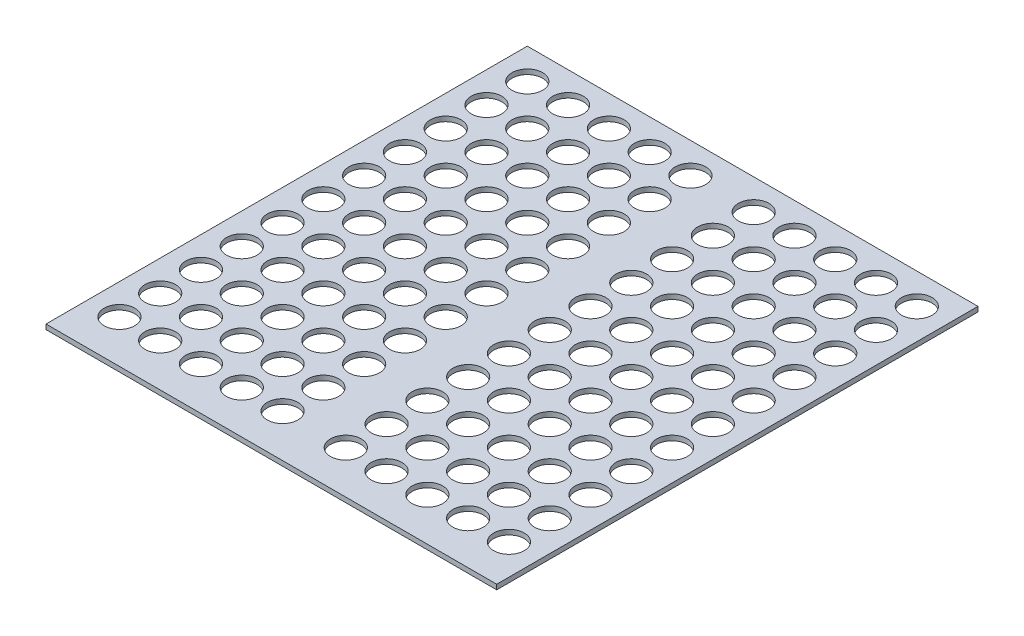
from build123d import *

# Parameters (mm, degrees)
SKETCH1_W           = 110.5
SKETCH1_H           = 118
BOSS_EXTRUDE1_DEPTH = 1.2
CUT_EXTRUDE1_REACH  = 82.839
SKETCH2_R           = 3.75
LPATTERN1_COUNT     = 11
LPATTERN1_PITCH     = 10


with BuildPart() as part:
    # Sketch1 → Boss-Extrude1 (new body)
    with BuildSketch(Plane(origin=(0, 0, 0), x_dir=(1, 0, 0), z_dir=(0, 1, 0))):
        Rectangle(SKETCH1_W, SKETCH1_H)
    extrude(amount=BOSS_EXTRUDE1_DEPTH)

    # Sketch2 → Cut-Extrude1 (cut, up to next)
    with BuildSketch(Plane(origin=(0, 1.2, 0), x_dir=(1, 0, 0), z_dir=(0, 1, 0)), mode=Mode.PRIVATE) as cut_extrude1_sk1:
        with Locations(Location((-27.75, 51.5, 0), (0, 0, 270))):
            Circle(SKETCH2_R)
    cut_extrude1_tool1 = extrude(cut_extrude1_sk1.sketch, amount=-CUT_EXTRUDE1_REACH, mode=Mode.PRIVATE) & part.part
    # Sketch2 → Cut-Extrude1 (cut, up to next)
    with BuildSketch(Plane(origin=(0, 1.2, 0), x_dir=(1, 0, 0), z_dir=(0, 1, 0)), mode=Mode.PRIVATE) as cut_extrude1_sk2:
        with Locations(Location((-47.75, 51.5, 0), (0, 0, 270))):
            Circle(SKETCH2_R)
    cut_extrude1_tool2 = extrude(cut_extrude1_sk2.sketch, amount=-CUT_EXTRUDE1_REACH, mode=Mode.PRIVATE) & part.part
    # Sketch2 → Cut-Extrude1 (cut, up to next)
    with BuildSketch(Plane(origin=(0, 1.2, 0), x_dir=(1, 0, 0), z_dir=(0, 1, 0)), mode=Mode.PRIVATE) as cut_extrude1_sk3:
        with Locations(Location((17.75, 51.5, 0), (0, 0, 270))):
            Circle(SKETCH2_R)
    cut_extrude1_tool3 = extrude(cut_extrude1_sk3.sketch, amount=-CUT_EXTRUDE1_REACH, mode=Mode.PRIVATE) & part.part
    # Sketch2 → Cut-Extrude1 (cut, up to next)
    with BuildSketch(Plane(origin=(0, 1.2, 0), x_dir=(1, 0, 0), z_dir=(0, 1, 0)), mode=Mode.PRIVATE) as cut_extrude1_sk4:
        with Locations(Location((27.75, 51.5, 0), (0, 0, 270))):
            Circle(SKETCH2_R)
    cut_extrude1_tool4 = extrude(cut_extrude1_sk4.sketch, amount=-CUT_EXTRUDE1_REACH, mode=Mode.PRIVATE) & part.part
    # Sketch2 → Cut-Extrude1 (cut, up to next)
    with BuildSketch(Plane(origin=(0, 1.2, 0), x_dir=(1, 0, 0), z_dir=(0, 1, 0)), mode=Mode.PRIVATE) as cut_extrude1_sk5:
        with Locations(Location((47.75, 51.5, 0), (0, 0, 270))):
            Circle(SKETCH2_R)
    cut_extrude1_tool5 = extrude(cut_extrude1_sk5.sketch, amount=-CUT_EXTRUDE1_REACH, mode=Mode.PRIVATE) & part.part
    # Sketch2 → Cut-Extrude1 (cut, up to next)
    with BuildSketch(Plane(origin=(0, 1.2, 0), x_dir=(1, 0, 0), z_dir=(0, 1, 0)), mode=Mode.PRIVATE) as cut_extrude1_sk6:
        with Locations(Location((37.75, 51.5, 0), (0, 0, 270))):
            Circle(SKETCH2_R)
    cut_extrude1_tool6 = extrude(cut_extrude1_sk6.sketch, amount=-CUT_EXTRUDE1_REACH, mode=Mode.PRIVATE) & part.part
    # Sketch2 → Cut-Extrude1 (cut, up to next)
    with BuildSketch(Plane(origin=(0, 1.2, 0), x_dir=(1, 0, 0), z_dir=(0, 1, 0)), mode=Mode.PRIVATE) as cut_extrude1_sk7:
        with Locations(Location((-17.75, 51.5, 0), (0, 0, 270))):
            Circle(SKETCH2_R)
    cut_extrude1_tool7 = extrude(cut_extrude1_sk7.sketch, amount=-CUT_EXTRUDE1_REACH, mode=Mode.PRIVATE) & part.part
    # Sketch2 → Cut-Extrude1 (cut, up to next)
    with BuildSketch(Plane(origin=(0, 1.2, 0), x_dir=(1, 0, 0), z_dir=(0, 1, 0)), mode=Mode.PRIVATE) as cut_extrude1_sk8:
        with Locations(Location((7.75, 51.5, 0), (0, 0, 270))):
            Circle(SKETCH2_R)
    cut_extrude1_tool8 = extrude(cut_extrude1_sk8.sketch, amount=-CUT_EXTRUDE1_REACH, mode=Mode.PRIVATE) & part.part
    # Sketch2 → Cut-Extrude1 (cut, up to next)
    with BuildSketch(Plane(origin=(0, 1.2, 0), x_dir=(1, 0, 0), z_dir=(0, 1, 0)), mode=Mode.PRIVATE) as cut_extrude1_sk9:
        with Locations(Location((-7.75, 51.5, 0), (0, 0, 270))):
            Circle(SKETCH2_R)
    cut_extrude1_tool9 = extrude(cut_extrude1_sk9.sketch, amount=-CUT_EXTRUDE1_REACH, mode=Mode.PRIVATE) & part.part
    # Sketch2 → Cut-Extrude1 (cut, up to next)
    with BuildSketch(Plane(origin=(0, 1.2, 0), x_dir=(1, 0, 0), z_dir=(0, 1, 0)), mode=Mode.PRIVATE) as cut_extrude1_sk10:
        with Locations(Location((-37.75, 51.5, 0), (0, 0, 270))):
            Circle(SKETCH2_R)
    cut_extrude1_tool10 = extrude(cut_extrude1_sk10.sketch, amount=-CUT_EXTRUDE1_REACH, mode=Mode.PRIVATE) & part.part
    cut_extrude1_1 = cut_extrude1_tool1.solids().sort_by_distance((-27.75, 1.2, -51.5))[0]
    add(cut_extrude1_1, mode=Mode.SUBTRACT)
    cut_extrude1_2 = cut_extrude1_tool2.solids().sort_by_distance((-47.75, 1.2, -51.5))[0]
    add(cut_extrude1_2, mode=Mode.SUBTRACT)
    cut_extrude1_3 = cut_extrude1_tool3.solids().sort_by_distance((17.75, 1.2, -51.5))[0]
    add(cut_extrude1_3, mode=Mode.SUBTRACT)
    cut_extrude1_4 = cut_extrude1_tool4.solids().sort_by_distance((27.75, 1.2, -51.5))[0]
    add(cut_extrude1_4, mode=Mode.SUBTRACT)
    cut_extrude1_5 = cut_extrude1_tool5.solids().sort_by_distance((47.75, 1.2, -51.5))[0]
    add(cut_extrude1_5, mode=Mode.SUBTRACT)
    cut_extrude1_6 = cut_extrude1_tool6.solids().sort_by_distance((37.75, 1.2, -51.5))[0]
    add(cut_extrude1_6, mode=Mode.SUBTRACT)
    cut_extrude1_7 = cut_extrude1_tool7.solids().sort_by_distance((-17.75, 1.2, -51.5))[0]
    add(cut_extrude1_7, mode=Mode.SUBTRACT)
    cut_extrude1_8 = cut_extrude1_tool8.solids().sort_by_distance((7.75, 1.2, -51.5))[0]
    add(cut_extrude1_8, mode=Mode.SUBTRACT)
    cut_extrude1_9 = cut_extrude1_tool9.solids().sort_by_distance((-7.75, 1.2, -51.5))[0]
    add(cut_extrude1_9, mode=Mode.SUBTRACT)
    cut_extrude1_10 = cut_extrude1_tool10.solids().sort_by_distance((-37.75, 1.2, -51.5))[0]
    add(cut_extrude1_10, mode=Mode.SUBTRACT)
    cut_extrude1 = cut_extrude1_1 + cut_extrude1_2 + cut_extrude1_3 + cut_extrude1_4 + cut_extrude1_5 + cut_extrude1_6 + cut_extrude1_7 + cut_extrude1_8 + cut_extrude1_9 + cut_extrude1_10  # Cut-Extrude1 as one shape, for the pattern or mirror that repeats it

    # LPattern1: Cut-Extrude1 ×11
    with Locations(*[(0, 0, i * LPATTERN1_PITCH) for i in range(1, LPATTERN1_COUNT)]):
        add(cut_extrude1, mode=Mode.SUBTRACT)


solid = part.part
